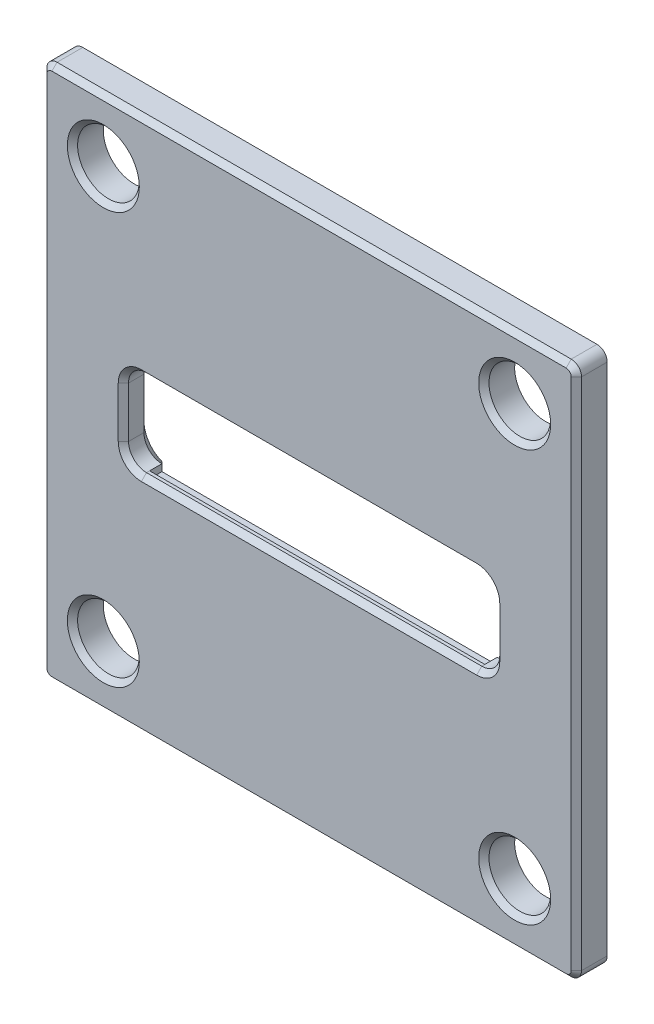
from build123d import *

# Parameters (mm, degrees)
SKETCH1_R           = 3
BOSS_EXTRUDE1_DEPTH = 3
SKETCH2_W           = 32.6
SKETCH2_H           = 9.75
CUT_EXTRUDE1_DEPTH  = 2.2
CHAMFER1_SIZE       = 1
CHAMFER3_SIZE       = 0.5


with BuildPart() as part:
    # Sketch1 → Boss-Extrude1 (new body)
    with BuildSketch(Plane(origin=(0, 0, 0), x_dir=(0, 1, 0), z_dir=(0, 0, 1))):
        with BuildLine():
            Line((-25, 26), (25, 26))
            ThreePointArc((25, 26), (25.707106781, 25.707106781), (26, 25))
            Line((26, 25), (26, 6.375))
            Line((26, 6.375), (26, -6.375))
            Line((26, -6.375), (26, -25))
            ThreePointArc((26, -25), (25.707106781, -25.707106781), (25, -26))
            Line((25, -26), (-25, -26))
            ThreePointArc((-25, -26), (-25.707106781, -25.707106781), (-26, -25))
            Line((-26, -25), (-26, -6.375))
            Line((-26, -6.375), (-26, 6.375))
            Line((-26, 6.375), (-26, 25))
            ThreePointArc((-26, 25), (-25.707106781, 25.707106781), (-25, 26))
        make_face()
        with Locations(Location((-20, 20, 0), (0, 0, 270))):
            Circle(SKETCH1_R, mode=Mode.SUBTRACT)
        with Locations(Location((20, 20, 0), (0, 0, 270))):
            Circle(SKETCH1_R, mode=Mode.SUBTRACT)
        with Locations(Location((20, -20, 0), (0, 0, 270))):
            Circle(SKETCH1_R, mode=Mode.SUBTRACT)
        with Locations(Location((-20, -20, 0), (0, 0, 270))):
            Circle(SKETCH1_R, mode=Mode.SUBTRACT)
        with BuildLine():
            Line((-2.46, 18.05), (2.46, 18.05))
            ThreePointArc((2.46, 18.05), (3.697436867, 17.537436867), (4.21, 16.3))
            Line((4.21, 16.3), (4.21, -16.3))
            ThreePointArc((4.21, -16.3), (3.697436867, -17.537436867), (2.46, -18.05))
            Line((2.46, -18.05), (-2.46, -18.05))
            ThreePointArc((-2.46, -18.05), (-3.697436867, -17.537436867), (-4.21, -16.3))
            Line((-4.21, -16.3), (-4.21, 16.3))
            ThreePointArc((-4.21, 16.3), (-3.697436867, 17.537436867), (-2.46, 18.05))
        make_face(mode=Mode.SUBTRACT)
    extrude(amount=BOSS_EXTRUDE1_DEPTH)

    # Sketch2 → Cut-Extrude1 (cut)
    with BuildSketch(Plane(origin=(0, 0, 0), x_dir=(1, 0, 0), z_dir=(0, 0, -1))):
        Rectangle(SKETCH2_W, SKETCH2_H)
    extrude(amount=-CUT_EXTRUDE1_DEPTH, mode=Mode.SUBTRACT)

    # Chamfer1
    chamfer1_edges = [part.edges().sort_by_distance(p)[0] for p in [
        (17.537436867, -3.697436867, 0),
        (18.05, 0, 0),
        (17.537436867, 3.697436867, 0),
        (-17.537436867, 3.697436867, 0),
        (-18.05, 0, 0),
        (-17.537436867, -3.697436867, 0),
        (16.3, 4.5425, 0),
        (-16.3, 4.5425, 0),
        (0, 4.875, 0),
        (-16.3, -4.5425, 0),
        (16.3, -4.5425, 0),
        (0, -4.875, 0),
    ]]
    chamfer(chamfer1_edges, length=CHAMFER1_SIZE)

    # Chamfer3
    chamfer3_edges = [part.edges().sort_by_distance(p)[0] for p in [
        (25.707106781, -25.707106781, 3),
        (26, 0, 3),
        (25.707106781, 25.707106781, 3),
        (0, 26, 3),
        (-23, -20, 3),
        (-23, 20, 3),
        (17, 20, 3),
        (-25.707106781, 25.707106781, 3),
        (17, -20, 3),
        (-26, 0, 3),
        (-25.707106781, -25.707106781, 3),
        (17.537436867, -3.697436867, 3),
        (18.05, 0, 3),
        (17.537436867, 3.697436867, 3),
        (0, 4.21, 3),
        (-17.537436867, 3.697436867, 3),
        (-18.05, 0, 3),
        (-17.537436867, -3.697436867, 3),
        (0, -4.21, 3),
        (0, -26, 3),
    ]]
    chamfer(chamfer3_edges, length=CHAMFER3_SIZE)


solid = part.part
